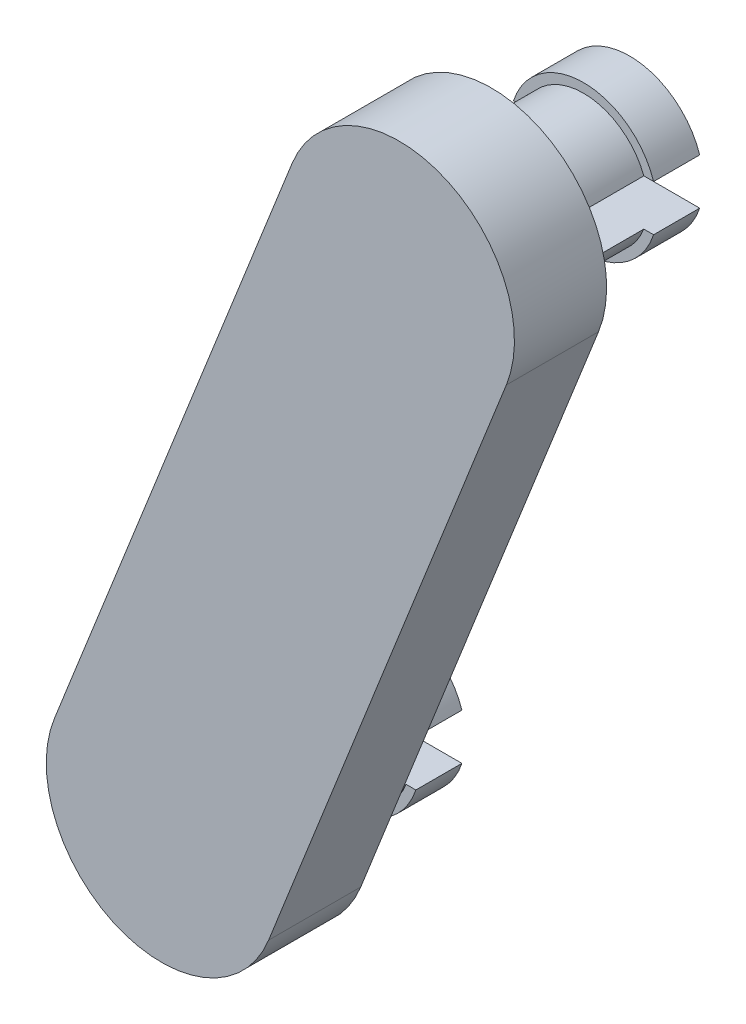
from build123d import *

# Parameters (mm, degrees)
BOSS_EXTRU_1_DEPTH      = 2
ESQUISSE2_R             = 1.4
BOSS_EXTRU_2_DEPTH      = 2
ESQUISSE3_R             = 1.6
BOSS_EXTRU_3_DEPTH      = 1
ESQUISSE4_W             = 4
ESQUISSE4_H             = 1
ENL_V_MAT_EXTRU_1_DEPTH = 3


with BuildPart() as part:
    # Esquisse1 → Boss.-Extru.1 (new body)
    with BuildSketch(Plane.XY):
        with BuildLine():
            Line((-27.09345354, 2.075059053), (-32.253315255, -10.939387807))
            ThreePointArc((-32.253315255, -10.939387807), (-35.4987275, -12.341992297), (-36.901331991, -9.096580052))
            Line((-36.901331991, -9.096580052), (-31.741470275, 3.917866809))
            ThreePointArc((-31.741470275, 3.917866809), (-28.49605803, 5.320471299), (-27.09345354, 2.075059053))
        make_face()
    extrude(amount=BOSS_EXTRU_1_DEPTH)

    # Esquisse2 → Boss.-Extru.2 (add)
    with BuildSketch(Plane(origin=(0, 0, 0), x_dir=(-1, 0, 0), z_dir=(0, 0, -1))):
        with Locations(Location((29.417461908, 2.996462931, 0), (0, 0, 180))):
            Circle(ESQUISSE2_R)
        with Locations(Location((34.577323623, -10.017983929, 0), (0, 0, 180))):
            Circle(ESQUISSE2_R)
    extrude(amount=BOSS_EXTRU_2_DEPTH)

    # Esquisse3 → Boss.-Extru.3 (add)
    with BuildSketch(Plane(origin=(0, 0, -2), x_dir=(-1, 0, 0), z_dir=(0, 0, -1))):
        with Locations((34.577323623, -10.017983929)):
            Circle(ESQUISSE3_R)
        with Locations((29.417461908, 2.996462931)):
            Circle(ESQUISSE3_R)
    extrude(amount=BOSS_EXTRU_3_DEPTH)

    # Esquisse4 → Enlèv. mat.-Extru.1 (cut)
    with BuildSketch(Plane(origin=(0, 0, -3), x_dir=(-1, 0, 0), z_dir=(0, 0, -1))):
        with Locations((29.417461908, 2.996462931)):
            Rectangle(ESQUISSE4_W, ESQUISSE4_H)
        with Locations((34.577323623, -10.017983929)):
            Rectangle(ESQUISSE4_W, ESQUISSE4_H)
    extrude(amount=-ENL_V_MAT_EXTRU_1_DEPTH, mode=Mode.SUBTRACT)


solid = part.part
